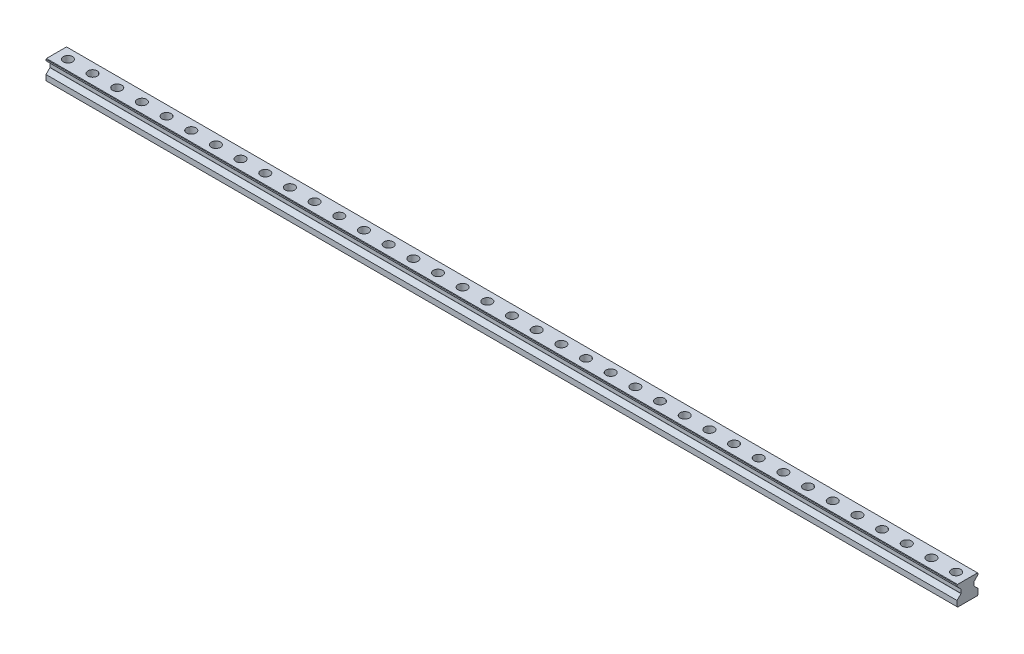
from build123d import *

# Parameters (mm, degrees)
BOSS_EXTRUDE2_DEPTH            = 738.5
CBORE_FOR_M8_SHCS1_D           = 9
CBORE_FOR_M8_SHCS1_CBORE_D     = 15
CBORE_FOR_M8_SHCS1_CBORE_DEPTH = 17
LPATTERN1_COUNT                = 37
LPATTERN1_PITCH                = 40


with BuildPart() as part:
    # Sketch2 → Boss-Extrude2 (new, symmetric)
    with BuildSketch(Plane(origin=(0, 0, 0), x_dir=(0, 0, -1), z_dir=(1, 0, 0))):
        with BuildLine():
            Line((10.617157288, 22.759079349), (17, 29.141922061))
            Line((17, 29.141922061), (17, 31.25))
            Line((17, 31.25), (16.25, 32))
            Line((16.25, 32), (-16.25, 32))
            Line((-16.25, 32), (-17, 31.25))
            Line((-17, 31.25), (-17, 29.141922061))
            Line((-17, 29.141922061), (-10.617157288, 22.759079349))
            ThreePointArc((-10.617157288, 22.759079349), (-10.530448187, 22.629310009), (-10.5, 22.476236636))
            Line((-10.5, 22.476236636), (-10.5, 16.523763364))
            ThreePointArc((-10.5, 16.523763364), (-10.530448187, 16.370689991), (-10.617157288, 16.240920651))
            Line((-10.617157288, 16.240920651), (-17, 9.858077939))
            Line((-17, 9.858077939), (-17, 1))
            Line((-17, 1), (-16, 0))
            Line((-16, 0), (16, 0))
            Line((16, 0), (17, 1))
            Line((17, 1), (17, 9.858077939))
            Line((17, 9.858077939), (10.617157288, 16.240920651))
            ThreePointArc((10.617157288, 16.240920651), (10.530448187, 16.370689991), (10.5, 16.523763364))
            Line((10.5, 16.523763364), (10.5, 22.476236636))
            ThreePointArc((10.5, 22.476236636), (10.530448187, 22.629310009), (10.617157288, 22.759079349))
        make_face()
    extrude(amount=BOSS_EXTRUDE2_DEPTH, both=True)

    # CBORE for M8 SHCS1 (through all)
    with Locations(Plane(origin=(0, 32, 0), x_dir=(-1, 0, 0), z_dir=(0, 1, 0))):
        with Locations((-720, 0)):
            cbore_for_m8_shcs1 = CounterBoreHole(CBORE_FOR_M8_SHCS1_D / 2, CBORE_FOR_M8_SHCS1_CBORE_D / 2, CBORE_FOR_M8_SHCS1_CBORE_DEPTH)

    # LPattern1: CBORE for M8 SHCS1 ×37
    with Locations(*[(-i * LPATTERN1_PITCH, 0, 0) for i in range(1, LPATTERN1_COUNT)]):
        add(cbore_for_m8_shcs1, mode=Mode.SUBTRACT)


solid = part.part
